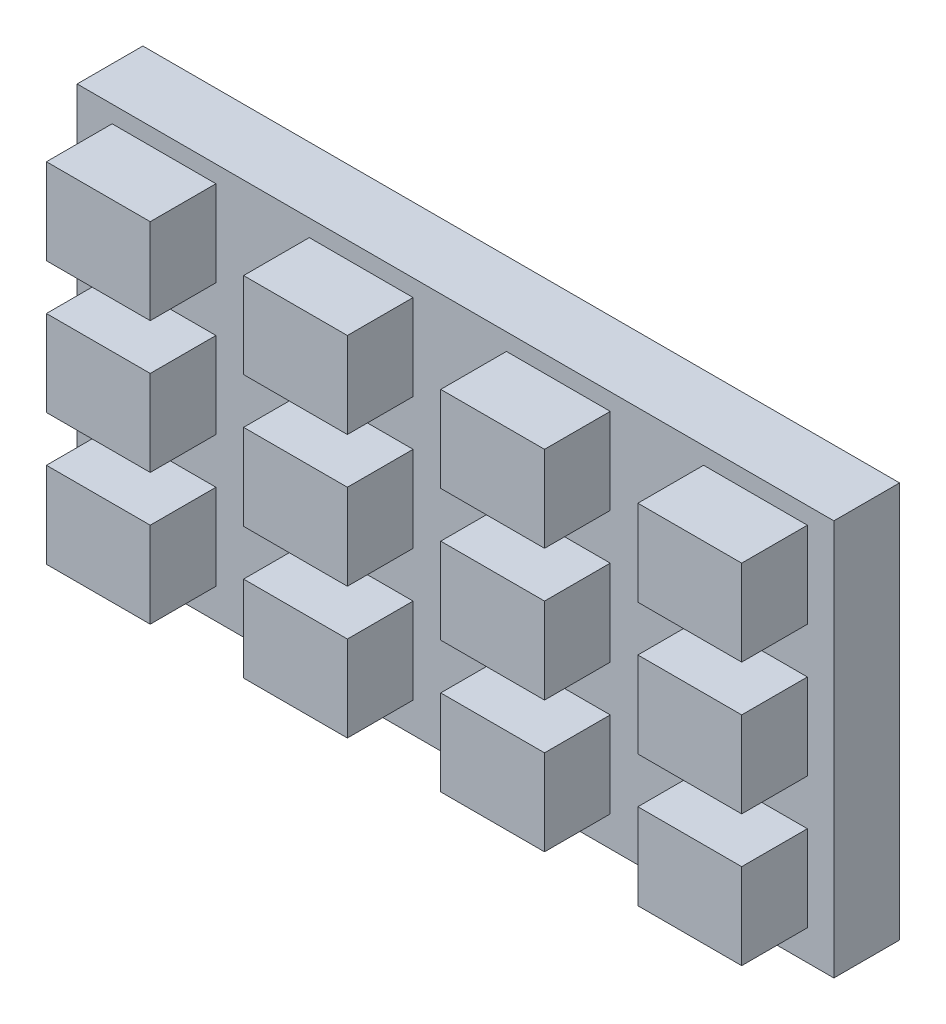
from build123d import *

# Parameters (mm, degrees)
SKETCH1_W              = 15.796409329
SKETCH1_H              = 13.049207706
BOSS_EXTRUDE2_DEPTH    = 10
BOSS_EXTRUDE2_2_DEPTH  = 10
BOSS_EXTRUDE2_3_DEPTH  = 10
BOSS_EXTRUDE2_4_DEPTH  = 10
BOSS_EXTRUDE2_5_DEPTH  = 10
BOSS_EXTRUDE2_6_DEPTH  = 10
BOSS_EXTRUDE2_7_DEPTH  = 10
BOSS_EXTRUDE2_8_DEPTH  = 10
BOSS_EXTRUDE2_9_DEPTH  = 10
BOSS_EXTRUDE2_10_DEPTH = 10
BOSS_EXTRUDE2_11_DEPTH = 10
BOSS_EXTRUDE2_12_DEPTH = 10
SKETCH2_W              = 115.149189571
SKETCH2_H              = 60.247442975
BOSS_EXTRUDE3_DEPTH    = 10


with BuildPart() as part:
    # Sketch1 → Boss-Extrude2 (new body)
    with BuildSketch(Plane.XY):
        with Locations((-24.600632245, -22.14931308)):
            Rectangle(SKETCH1_W, SKETCH1_H)
    extrude(amount=BOSS_EXTRUDE2_DEPTH)



with BuildPart() as body_2:
    # Sketch1 → Boss-Extrude2 2 (new body)
    with BuildSketch(Plane.XY):
        with Locations((-54.600632245, -22.14931308)):
            Rectangle(SKETCH1_W, SKETCH1_H)
    extrude(amount=BOSS_EXTRUDE2_2_DEPTH)


with BuildPart() as body_3:
    # Sketch1 → Boss-Extrude2 3 (new body)
    with BuildSketch(Plane.XY):
        with Locations((5.399367756, -22.14931308)):
            Rectangle(SKETCH1_W, SKETCH1_H)
    extrude(amount=BOSS_EXTRUDE2_3_DEPTH)


with BuildPart() as body_4:
    # Sketch1 → Boss-Extrude2 4 (new body)
    with BuildSketch(Plane.XY):
        with Locations((35.399367756, -22.14931308)):
            Rectangle(SKETCH1_W, SKETCH1_H)
    extrude(amount=BOSS_EXTRUDE2_4_DEPTH)


with BuildPart() as body_5:
    # Sketch1 → Boss-Extrude2 5 (new body)
    with BuildSketch(Plane.XY):
        with Locations((-24.600632245, -2.14931308)):
            Rectangle(SKETCH1_W, SKETCH1_H)
    extrude(amount=BOSS_EXTRUDE2_5_DEPTH)


with BuildPart() as body_6:
    # Sketch1 → Boss-Extrude2 6 (new body)
    with BuildSketch(Plane.XY):
        with Locations((5.399367756, -2.14931308)):
            Rectangle(SKETCH1_W, SKETCH1_H)
    extrude(amount=BOSS_EXTRUDE2_6_DEPTH)


with BuildPart() as body_7:
    # Sketch1 → Boss-Extrude2 7 (new body)
    with BuildSketch(Plane.XY):
        with Locations((35.399367756, -2.14931308)):
            Rectangle(SKETCH1_W, SKETCH1_H)
    extrude(amount=BOSS_EXTRUDE2_7_DEPTH)


with BuildPart() as body_8:
    # Sketch1 → Boss-Extrude2 8 (new body)
    with BuildSketch(Plane.XY):
        with Locations((-24.600632245, 17.85068692)):
            Rectangle(SKETCH1_W, SKETCH1_H)
    extrude(amount=BOSS_EXTRUDE2_8_DEPTH)


with BuildPart() as body_9:
    # Sketch1 → Boss-Extrude2 9 (new body)
    with BuildSketch(Plane.XY):
        with Locations((5.399367756, 17.85068692)):
            Rectangle(SKETCH1_W, SKETCH1_H)
    extrude(amount=BOSS_EXTRUDE2_9_DEPTH)


with BuildPart() as body_10:
    # Sketch1 → Boss-Extrude2 10 (new body)
    with BuildSketch(Plane.XY):
        with Locations((35.399367756, 17.85068692)):
            Rectangle(SKETCH1_W, SKETCH1_H)
    extrude(amount=BOSS_EXTRUDE2_10_DEPTH)


with BuildPart() as body_11:
    # Sketch1 → Boss-Extrude2 11 (new body)
    with BuildSketch(Plane.XY):
        with Locations((-54.600632245, -2.14931308)):
            Rectangle(SKETCH1_W, SKETCH1_H)
    extrude(amount=BOSS_EXTRUDE2_11_DEPTH)


with BuildPart() as body_12:
    # Sketch1 → Boss-Extrude2 12 (new body)
    with BuildSketch(Plane.XY):
        with Locations((-54.600632245, 17.85068692)):
            Rectangle(SKETCH1_W, SKETCH1_H)
    extrude(amount=BOSS_EXTRUDE2_12_DEPTH)


with BuildPart() as part_1:
    add(part.part)

    add(body_2.part)  # Boss-Extrude3 merges body 2

    add(body_3.part)  # Boss-Extrude3 merges body 3

    add(body_4.part)  # Boss-Extrude3 merges body 4

    add(body_5.part)  # Boss-Extrude3 merges body 5

    add(body_6.part)  # Boss-Extrude3 merges body 6

    add(body_7.part)  # Boss-Extrude3 merges body 7

    add(body_8.part)  # Boss-Extrude3 merges body 8

    add(body_9.part)  # Boss-Extrude3 merges body 9

    add(body_10.part)  # Boss-Extrude3 merges body 10

    add(body_11.part)  # Boss-Extrude3 merges body 11

    add(body_12.part)  # Boss-Extrude3 merges body 12
    # Sketch2 → Boss-Extrude3 (add)
    with BuildSketch(Plane.XY):
        with Locations((-10.250784507, -3.160661043)):
            Rectangle(SKETCH2_W, SKETCH2_H)
    extrude(amount=-BOSS_EXTRUDE3_DEPTH)


solid = part_1.part
